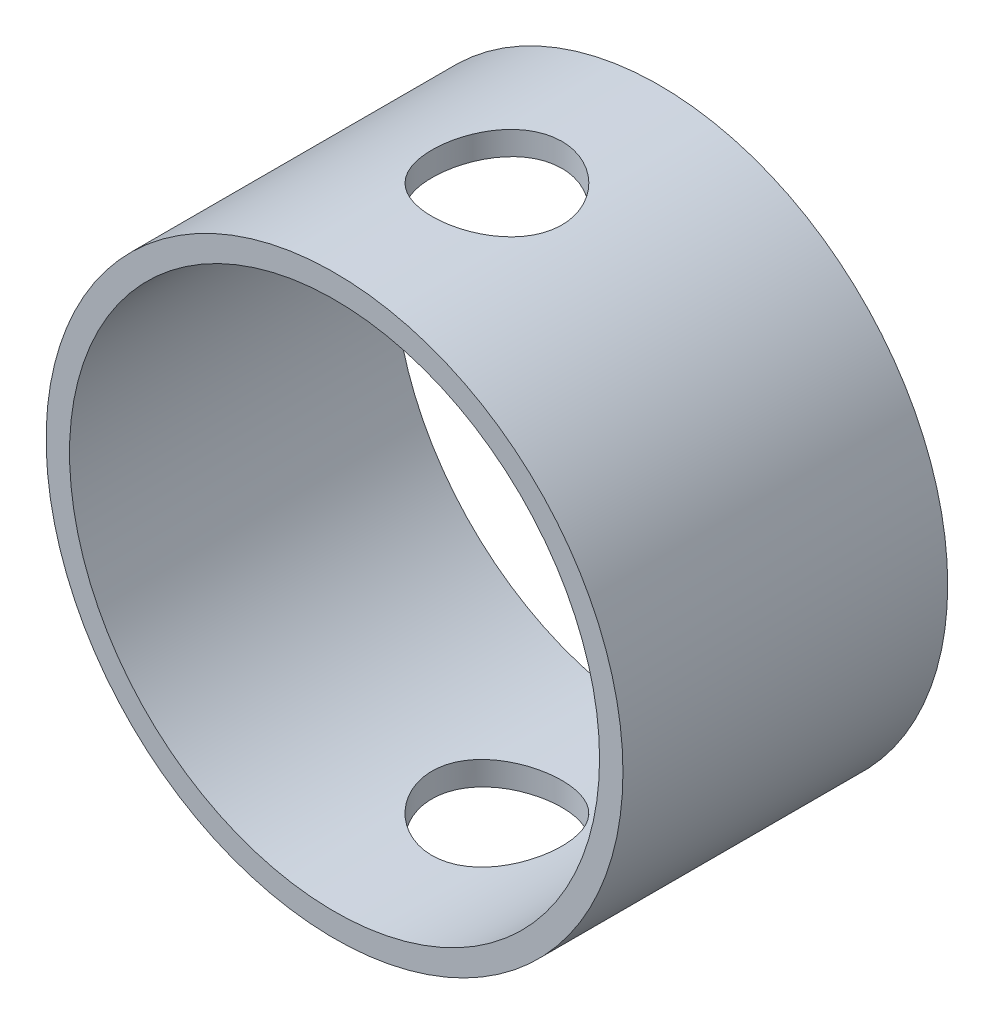
from build123d import *

# Parameters (mm, degrees)
SKETCH1_R               = 254
SKETCH1_R_2             = 233.4
BOSS_EXTRUDE1_DEPTH     = 143
CUT_EXTRUDE1_DEPTH      = 387.627727924
CUT_EXTRUDE1_DEPTH_BACK = 387.627727924
SKETCH2_R               = 57.25


with BuildPart() as part:
    # Sketch1 → Boss-Extrude1 (new, symmetric)
    with BuildSketch(Plane.XY):
        Circle(SKETCH1_R)
        Circle(SKETCH1_R_2, mode=Mode.SUBTRACT)
    extrude(amount=BOSS_EXTRUDE1_DEPTH, both=True)

    # Sketch2 → Cut-Extrude1 (cut, two sides: drawn at the far end of the back side and taken through both)
    with BuildSketch(Plane(origin=(0, 0, 0), x_dir=(1, 0, 0), z_dir=(0, 1, 0)).offset(-CUT_EXTRUDE1_DEPTH_BACK)):
        with Locations(Location((0, 0, 0), (0, 0, 90))):
            Circle(SKETCH2_R)
    extrude(amount=CUT_EXTRUDE1_DEPTH + CUT_EXTRUDE1_DEPTH_BACK, mode=Mode.SUBTRACT)


solid = part.part
